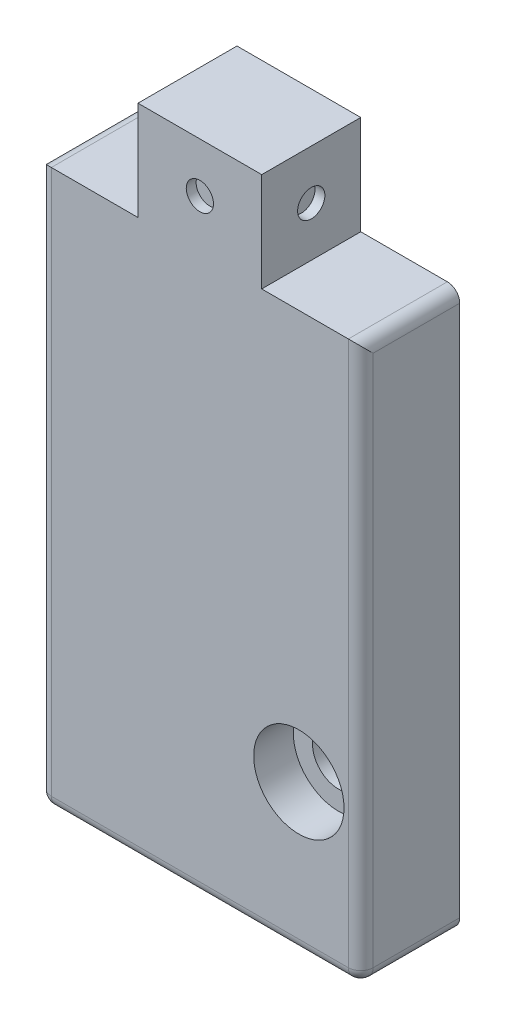
from build123d import *

# Parameters (mm, degrees)
SKETCH1_R           = 2.667
BOSS_EXTRUDE1_DEPTH = 10.16
SKETCH7_R           = 4.6355
CUT_EXTRUDE1_DEPTH  = 4.064
SKETCH3_R           = 1.397
CUT_EXTRUDE2_DEPTH  = 1.016
SKETCH8_R           = 1.397
CUT_EXTRUDE3_DEPTH  = 1.016
CUT_EXTRUDE4_START  = -1.016
SKETCH9_R           = 1.397
CUT_EXTRUDE4_DEPTH  = 1.016
FILLET1_R           = 1.27


with BuildPart() as part:
    # Sketch1 → Boss-Extrude1 (new body)
    with BuildSketch(Plane.XY):
        Polygon((0, 57.15), (10.16, 57.15), (10.16, 67.31), (22.86, 67.31), (22.86, 57.15), (33.02, 57.15), (33.02, 0), (0, 0), align=None)
        with Locations((26.67, 15.24)):
            Circle(SKETCH1_R, mode=Mode.SUBTRACT)
    extrude(amount=BOSS_EXTRUDE1_DEPTH)

    # Sketch7 → Cut-Extrude1 (cut)
    with BuildSketch(Plane.XY.offset(10.16)):
        with Locations((26.67, 15.24)):
            Circle(SKETCH7_R)
    extrude(amount=-CUT_EXTRUDE1_DEPTH, mode=Mode.SUBTRACT)

    # Sketch3 → Cut-Extrude2 (cut)
    with BuildSketch(Plane(origin=(0, 0, 10.16), x_dir=(-1, 0, 0), z_dir=(0, 0, -1))):
        with Locations((-16.51, 62.23)):
            Circle(SKETCH3_R)
    extrude(amount=CUT_EXTRUDE2_DEPTH, mode=Mode.SUBTRACT)

    # Sketch8 → Cut-Extrude3 (cut)
    with BuildSketch(Plane(origin=(22.86, 0, 0), x_dir=(0, 0, -1), z_dir=(1, 0, 0))):
        with Locations((-5.08, 62.23)):
            Circle(SKETCH8_R)
    extrude(amount=-CUT_EXTRUDE3_DEPTH, mode=Mode.SUBTRACT)

    # Sketch9 → Cut-Extrude4 (cut)
    with BuildSketch(Plane.ZY.offset(-10.16).offset(CUT_EXTRUDE4_START)):
        with Locations(Location((5.08, 62.23, 0), (0, 0, 180))):
            Circle(SKETCH9_R)
    extrude(amount=CUT_EXTRUDE4_DEPTH, mode=Mode.SUBTRACT)

    # Fillet1
    fillet1_edges = [part.edges().sort_by_distance(p)[0] for p in [
        (33.02, 28.575, 10.16),
        (0, 57.15, 5.08),
        (33.02, 57.15, 5.08),
        (33.02, 0, 5.08),
        (0, 0, 5.08),
        (0, 28.575, 10.16),
        (16.51, 0, 10.16),
    ]]
    fillet(fillet1_edges, radius=FILLET1_R)


solid = part.part
